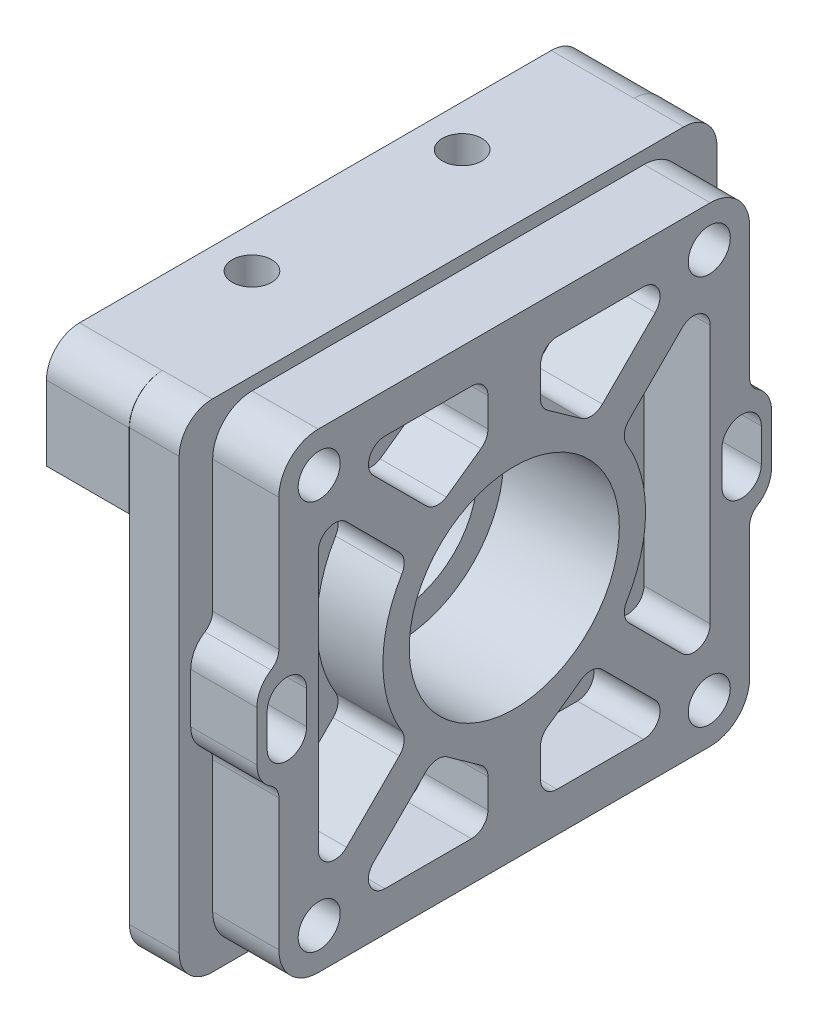
from build123d import *

# Parameters (mm, degrees)
SKETCH3_R           = 2.54
BOSS_EXTRUDE1_DEPTH = 10
SKETCH2_R           = 2.54
SKETCH2_R_2         = 12.7
BOSS_EXTRUDE2_DEPTH = 6
SKETCH4_R           = 12.7
SKETCH4_R_2         = 2.54
BOSS_EXTRUDE3_DEPTH = 8
SKETCH5_R           = 2.38125
CUT_EXTRUDE1_DEPTH  = 70


with BuildPart() as part:
    # Sketch3 → Boss-Extrude1 (new body)
    with BuildSketch(Plane(origin=(0, 0, 0), x_dir=(0, 0, -1), z_dir=(1, 0, 0))):
        with BuildLine():
            Line((32.460000001, 26), (32.460000001, 17))
            Line((32.460000001, 17), (22.011694736, 17))
            ThreePointArc((22.011694736, 17), (20.785715032, 16.58018156), (20.074424214, 15.496973764))
            Line((20.074424214, 15.496973764), (11.242399458, -18.931445665))
            ThreePointArc((11.242399458, -18.931445665), (0.051229837, -22.017914435), (-11.154181322, -18.983556558))
            Line((-11.154181322, -18.983556558), (-20.149993239, 15.504783566))
            ThreePointArc((-20.149993239, 15.504783566), (-20.862453065, 16.582650803), (-22.085243494, 17))
            Line((-22.085243494, 17), (-32.539999999, 17))
            Line((-32.539999999, 17), (-32.539999999, 26))
            ThreePointArc((-32.539999999, 26), (-31.368427124, 28.828427124), (-28.539999999, 30))
            Line((-28.539999999, 30), (28.460000001, 30))
            ThreePointArc((28.460000001, 30), (31.288427125, 28.828427124), (32.460000001, 26))
        make_face()
        with Locations((-23.5712, 23.5712)):
            Circle(SKETCH3_R, mode=Mode.SUBTRACT)
        with Locations((23.5712, 23.5712)):
            Circle(SKETCH3_R, mode=Mode.SUBTRACT)
        with BuildLine():
            Line((-9.365008666, 1.738431537), (-6.243342957, 18.43092489))
            ThreePointArc((-6.243342957, 18.43092489), (-0.00846666, 23.621964814), (6.240230217, 18.447569655))
            Line((6.240230217, 18.447569655), (9.360339559, 1.763398668))
            ThreePointArc((9.360339559, 1.763398668), (0.012699982, -9.524986626), (-9.365008666, 1.738431537))
        make_face(mode=Mode.SUBTRACT)
    extrude(amount=BOSS_EXTRUDE1_DEPTH)

    # Sketch2 → Boss-Extrude2 (add)
    with BuildSketch(Plane(origin=(10, 0, 0), x_dir=(0, 0, -1), z_dir=(1, 0, 0))):
        with BuildLine():
            Line((-28.5, 30), (28.5, 30))
            ThreePointArc((28.5, 30), (31.328427125, 28.828427125), (32.5, 26))
            Line((32.5, 26), (32.5, -26))
            ThreePointArc((32.5, -26), (31.328427125, -28.828427125), (28.5, -30))
            Line((28.5, -30), (-28.5, -30))
            ThreePointArc((-28.5, -30), (-31.328427125, -28.828427125), (-32.5, -26))
            Line((-32.5, -26), (-32.5, 26))
            ThreePointArc((-32.5, 26), (-31.328427125, 28.828427125), (-28.5, 30))
        make_face()
        with Locations((-23.5712, 23.5712)):
            Circle(SKETCH2_R, mode=Mode.SUBTRACT)
        with Locations((23.5712, 23.5712)):
            Circle(SKETCH2_R, mode=Mode.SUBTRACT)
        with Locations((23.5712, -23.5712)):
            Circle(SKETCH2_R, mode=Mode.SUBTRACT)
        with Locations(Location((0, 0, 0), (0, 0, 127.997746865))):
            Circle(SKETCH2_R_2, mode=Mode.SUBTRACT)
        with Locations((-23.5712, -23.5712)):
            Circle(SKETCH2_R, mode=Mode.SUBTRACT)
        with BuildLine():
            Line((25.1, 2), (25.1, -2))
            ThreePointArc((25.1, -2), (27.48125, -4.38125), (29.8625, -2))
            Line((29.8625, -2), (29.8625, 2))
            ThreePointArc((29.8625, 2), (27.48125, 4.38125), (25.1, 2))
        make_face(mode=Mode.SUBTRACT)
        with BuildLine():
            Line((-29.8625, -2), (-29.8625, 2))
            ThreePointArc((-29.8625, 2), (-27.48125, 4.38125), (-25.1, 2))
            Line((-25.1, 2), (-25.1, -2))
            ThreePointArc((-25.1, -2), (-27.48125, -4.38125), (-29.8625, -2))
        make_face(mode=Mode.SUBTRACT)
    extrude(amount=BOSS_EXTRUDE2_DEPTH)

    # Sketch4 → Boss-Extrude3 (add)
    with BuildSketch(Plane(origin=(16, 0, 0), x_dir=(0, 0, -1), z_dir=(1, 0, 0))):
        with BuildLine():
            Line((-28.448, -7.771660717), (-28.448, -23.6855))
            ThreePointArc((-28.448, -23.6855), (-27.053096045, -27.053096045), (-23.6855, -28.448))
            Line((-23.6855, -28.448), (23.6855, -28.448))
            ThreePointArc((23.6855, -28.448), (27.053096045, -27.053096045), (28.448, -23.6855))
            Line((28.448, -23.6855), (28.448, -7.771660717))
            ThreePointArc((28.448, -7.771660717), (28.699853039, -6.800073252), (29.391982202, -6.073183043))
            ThreePointArc((29.391982202, -6.073183043), (30.644303408, -4.75796607), (31.1, -3))
            Line((31.1, -3), (31.1, 3))
            ThreePointArc((31.1, 3), (30.644303408, 4.75796607), (29.391982202, 6.073183043))
            ThreePointArc((29.391982202, 6.073183043), (28.699853039, 6.800073252), (28.448, 7.771660717))
            Line((28.448, 7.771660717), (28.448, 23.6855))
            ThreePointArc((28.448, 23.6855), (27.053096045, 27.053096045), (23.6855, 28.448))
            Line((23.6855, 28.448), (-23.6855, 28.448))
            ThreePointArc((-23.6855, 28.448), (-27.053096045, 27.053096045), (-28.448, 23.6855))
            Line((-28.448, 23.6855), (-28.448, 7.771660717))
            ThreePointArc((-28.448, 7.771660717), (-28.699853039, 6.800073252), (-29.391982202, 6.073183043))
            ThreePointArc((-29.391982202, 6.073183043), (-30.644303408, 4.75796607), (-31.1, 3))
            Line((-31.1, 3), (-31.1, -3))
            ThreePointArc((-31.1, -3), (-30.644303408, -4.75796607), (-29.391982202, -6.073183043))
            ThreePointArc((-29.391982202, -6.073183043), (-28.699853039, -6.800073252), (-28.448, -7.771660717))
        make_face()
        with Locations(Location((0, 0, 0), (0, 0, 127.997746865))):
            Circle(SKETCH4_R, mode=Mode.SUBTRACT)
        with Locations((23.5712, 23.5712)):
            Circle(SKETCH4_R_2, mode=Mode.SUBTRACT)
        with Locations((-23.5712, 23.5712)):
            Circle(SKETCH4_R_2, mode=Mode.SUBTRACT)
        with Locations((23.5712, -23.5712)):
            Circle(SKETCH4_R_2, mode=Mode.SUBTRACT)
        with Locations((-23.5712, -23.5712)):
            Circle(SKETCH4_R_2, mode=Mode.SUBTRACT)
        with BuildLine():
            Line((-15.624180672, 23.6855), (-5.175, 23.6855))
            ThreePointArc((-5.175, 23.6855), (-3.760786438, 23.099713562), (-3.175, 21.6855))
            Line((-3.175, 21.6855), (-3.175, 18.200129406))
            ThreePointArc((-3.175, 18.200129406), (-3.39755641, 17.283235582), (-4.015694283, 16.570402356))
            Line((-4.015694283, 16.570402356), (-8.206292299, 13.589422052))
            ThreePointArc((-8.206292299, 13.589422052), (-9.481700161, 13.316114711), (-10.654369458, 13.887261661))
            Line((-10.654369458, 13.887261661), (-17.038394234, 20.271286438))
            ThreePointArc((-17.038394234, 20.271286438), (-17.471939737, 22.450866865), (-15.624180672, 23.6855))
        make_face(mode=Mode.SUBTRACT)
        with BuildLine():
            Line((23.6855, 15.624180672), (23.6855, -15.624180672))
            ThreePointArc((23.6855, -15.624180672), (22.450866865, -17.471939737), (20.271286438, -17.038394234))
            Line((20.271286438, -17.038394234), (13.887261661, -10.654369458))
            ThreePointArc((13.887261661, -10.654369458), (13.316114711, -9.481700161), (13.589422052, -8.206292299))
            ThreePointArc((13.589422052, -8.206292299), (15.875, 0), (13.589422052, 8.206292299))
            ThreePointArc((13.589422052, 8.206292299), (13.316114711, 9.481700161), (13.887261661, 10.654369458))
            Line((13.887261661, 10.654369458), (20.271286438, 17.038394234))
            ThreePointArc((20.271286438, 17.038394234), (22.450866865, 17.471939737), (23.6855, 15.624180672))
        make_face(mode=Mode.SUBTRACT)
        with BuildLine():
            Line((17.038394234, -20.271286438), (10.654369458, -13.887261661))
            ThreePointArc((10.654369458, -13.887261661), (9.481700161, -13.316114711), (8.206292299, -13.589422052))
            Line((8.206292299, -13.589422052), (4.015694283, -16.570402356))
            ThreePointArc((4.015694283, -16.570402356), (3.39755641, -17.283235582), (3.175, -18.200129406))
            Line((3.175, -18.200129406), (3.175, -21.6855))
            ThreePointArc((3.175, -21.6855), (3.760786438, -23.099713562), (5.175, -23.6855))
            Line((5.175, -23.6855), (15.624180672, -23.6855))
            ThreePointArc((15.624180672, -23.6855), (17.471939737, -22.450866865), (17.038394234, -20.271286438))
        make_face(mode=Mode.SUBTRACT)
        with BuildLine():
            Line((-23.6855, -15.624180672), (-23.6855, 15.624180672))
            ThreePointArc((-23.6855, 15.624180672), (-22.450866865, 17.471939737), (-20.271286438, 17.038394234))
            Line((-20.271286438, 17.038394234), (-13.887261661, 10.654369458))
            ThreePointArc((-13.887261661, 10.654369458), (-13.316114711, 9.481700161), (-13.589422052, 8.206292299))
            ThreePointArc((-13.589422052, 8.206292299), (-15.875, 0), (-13.589422052, -8.206292299))
            ThreePointArc((-13.589422052, -8.206292299), (-13.316114711, -9.481700161), (-13.887261661, -10.654369458))
            Line((-13.887261661, -10.654369458), (-20.271286438, -17.038394234))
            ThreePointArc((-20.271286438, -17.038394234), (-22.450866865, -17.471939737), (-23.6855, -15.624180672))
        make_face(mode=Mode.SUBTRACT)
        with BuildLine():
            Line((17.038394234, 20.271286438), (10.654369458, 13.887261661))
            ThreePointArc((10.654369458, 13.887261661), (9.481700161, 13.316114711), (8.206292299, 13.589422052))
            Line((8.206292299, 13.589422052), (4.015694283, 16.570402356))
            ThreePointArc((4.015694283, 16.570402356), (3.39755641, 17.283235582), (3.175, 18.200129406))
            Line((3.175, 18.200129406), (3.175, 21.6855))
            ThreePointArc((3.175, 21.6855), (3.760786438, 23.099713562), (5.175, 23.6855))
            Line((5.175, 23.6855), (15.624180672, 23.6855))
            ThreePointArc((15.624180672, 23.6855), (17.471939737, 22.450866865), (17.038394234, 20.271286438))
        make_face(mode=Mode.SUBTRACT)
        with BuildLine():
            Line((-3.175, -21.6855), (-3.175, -18.200129406))
            ThreePointArc((-3.175, -18.200129406), (-3.39755641, -17.283235582), (-4.015694283, -16.570402356))
            Line((-4.015694283, -16.570402356), (-8.206292299, -13.589422052))
            ThreePointArc((-8.206292299, -13.589422052), (-9.481700161, -13.316114711), (-10.654369458, -13.887261661))
            Line((-10.654369458, -13.887261661), (-17.038394234, -20.271286438))
            ThreePointArc((-17.038394234, -20.271286438), (-17.471939737, -22.450866865), (-15.624180672, -23.6855))
            Line((-15.624180672, -23.6855), (-5.175, -23.6855))
            ThreePointArc((-5.175, -23.6855), (-3.760786438, -23.099713562), (-3.175, -21.6855))
        make_face(mode=Mode.SUBTRACT)
        with BuildLine():
            Line((25.1, 2), (25.1, -2))
            ThreePointArc((25.1, -2), (27.48125, -4.38125), (29.8625, -2))
            Line((29.8625, -2), (29.8625, 2))
            ThreePointArc((29.8625, 2), (27.48125, 4.38125), (25.1, 2))
        make_face(mode=Mode.SUBTRACT)
        with BuildLine():
            Line((-29.8625, -2), (-29.8625, 2))
            ThreePointArc((-29.8625, 2), (-27.48125, 4.38125), (-25.1, 2))
            Line((-25.1, 2), (-25.1, -2))
            ThreePointArc((-25.1, -2), (-27.48125, -4.38125), (-29.8625, -2))
        make_face(mode=Mode.SUBTRACT)
    extrude(amount=BOSS_EXTRUDE3_DEPTH)

    # Sketch5 → Cut-Extrude1 (cut)
    with BuildSketch(Plane(origin=(0, 30, 0), x_dir=(-1, 0, 0), z_dir=(0, 1, 0))):
        with Locations(Location((-5, -12.7, 0), (0, 0, 90))):
            Circle(SKETCH5_R)
        with Locations(Location((-5, 12.7, 0), (0, 0, 90))):
            Circle(SKETCH5_R)
    extrude(amount=-CUT_EXTRUDE1_DEPTH, mode=Mode.SUBTRACT)


solid = part.part
